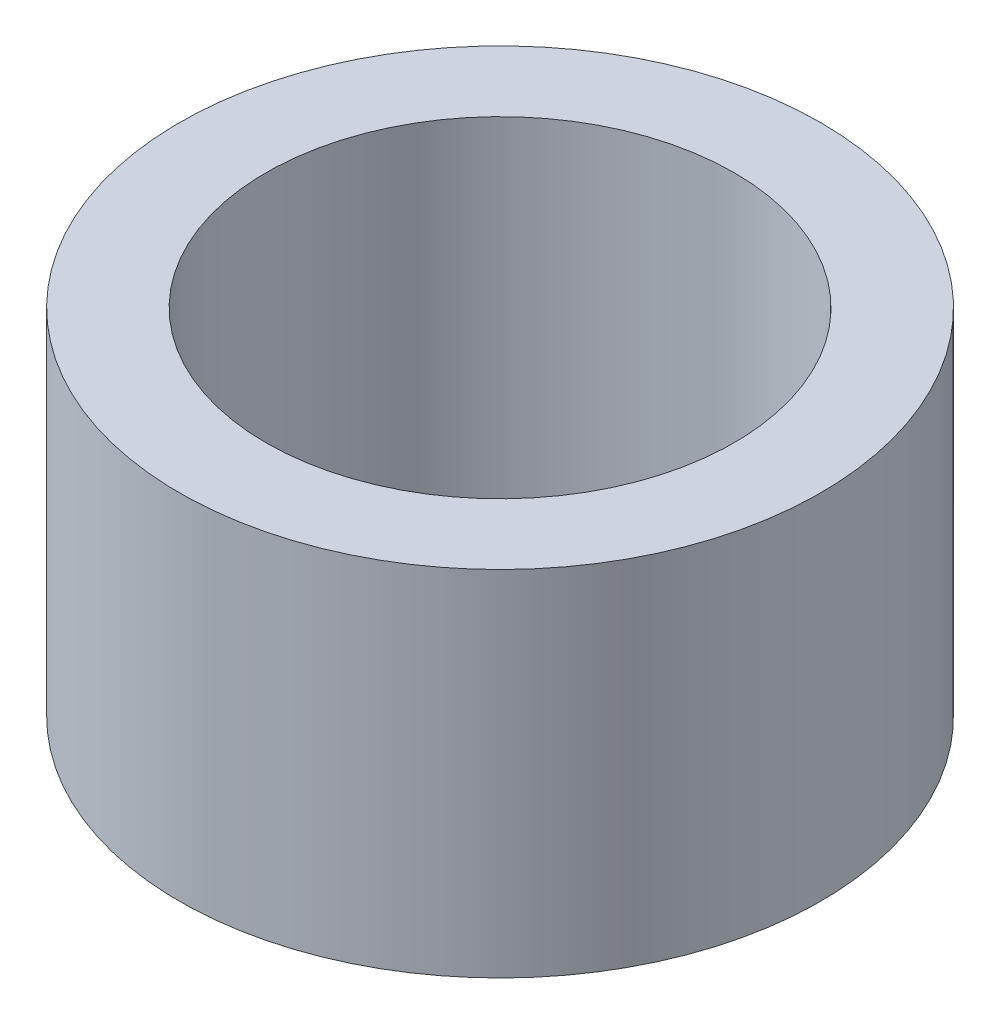
from build123d import *

# Parameters (mm, degrees)
SKETCH1_R           = 4.13258
SKETCH1_R_2         = 3.01625
BOSS_EXTRUDE1_DEPTH = 4.5593


with BuildPart() as part:
    # Sketch1 → Boss-Extrude1 (new body)
    with BuildSketch(Plane(origin=(0, 0, 0), x_dir=(1, 0, 0), z_dir=(0, 1, 0))):
        with Locations(Location((0, 0, 0), (0, 0, 90))):
            Circle(SKETCH1_R)
        with Locations(Location((0, 0, 0), (0, 0, 90))):
            Circle(SKETCH1_R_2, mode=Mode.SUBTRACT)
    extrude(amount=BOSS_EXTRUDE1_DEPTH)


solid = part.part
